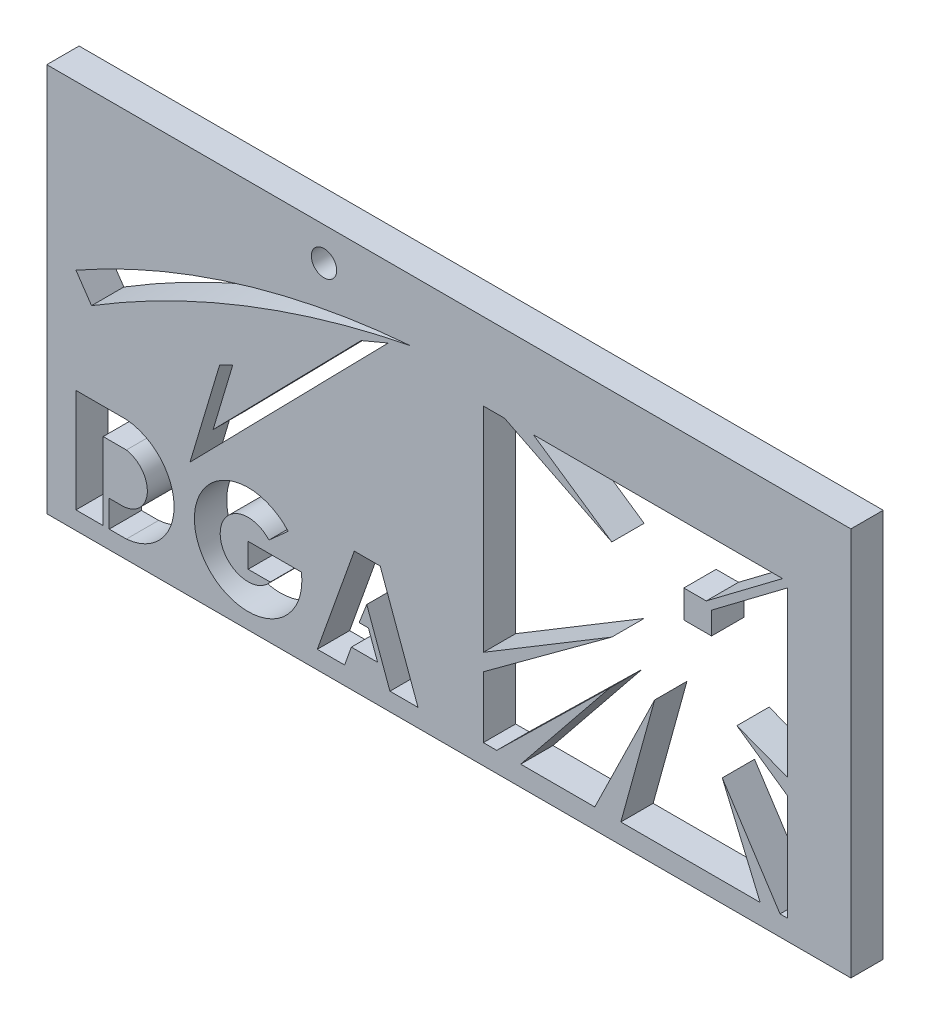
from build123d import *

# Parameters (mm, degrees)
SKETCH1_W           = 248.984951577
SKETCH1_H           = 120.432938534
SKETCH1_R           = 3.927622284
BOSS_EXTRUDE1_DEPTH = 10


with BuildPart() as part:
    # Sketch1 → Boss-Extrude1 (new body)
    with BuildSketch(Plane.XY):
        with Locations((115.469095844, 55.276599595)):
            Rectangle(SKETCH1_W, SKETCH1_H)
        with BuildLine():
            Line((0, 32.653955718), (15.621240173, 32.653955718))
            ThreePointArc((15.621240173, 32.653955718), (30.388379433, 16.62799554), (15.621240173, 0.602035363))
            Line((15.621240173, 0.602035363), (10.293959075, 0.602035363))
            Line((10.293959075, 0.602035363), (10.293959075, 8.861852454))
            Line((10.293959075, 8.861852454), (14.274680474, 8.861852454))
            ThreePointArc((14.274680474, 8.861852454), (22.080061465, 16.061509913), (15.621240173, 24.490191155))
            Line((15.621240173, 24.490191155), (8.429804398, 24.490191155))
            Line((8.429804398, 24.490191155), (8.429804398, 0.602035363))
            Line((8.429804398, 0.602035363), (0, 0.602035363))
            Line((0, 0.602035363), (0, 32.653955718))
        make_face(mode=Mode.SUBTRACT)
        with BuildLine():
            Line((53.313679211, 11.346247394), (53.313679211, 18.830088837))
            Line((53.313679211, 18.830088837), (69.812648012, 18.830088837))
            ThreePointArc((69.812648012, 18.830088837), (38.193038875, 9.668726743), (65.717255622, 27.728287366))
            Line((65.717255622, 27.728287366), (59.75927661, 22.396332813))
            ThreePointArc((59.75927661, 22.396332813), (44.669643003, 16.311643284), (60.163684849, 11.346247394))
            Line((60.163684849, 11.346247394), (53.313679211, 11.346247394))
        make_face(mode=Mode.SUBTRACT)
        Polygon((83.185651108, 0.602035363), (74.742166319, 0.602035363), (86.191958884, 32.653955718), (94.215171192, 32.653955718), (105.915689142, 0.602035363), (97.223875808, 0.602035363), (90.044966021, 20.267647237), (87.696137012, 14.219111042), (90.567743799, 14.219111042), (93.405960474, 6.444216356), (85.272632474, 6.444216356), align=None, mode=Mode.SUBTRACT)
        Polygon((165.929478775, 74.975053885), (141.623819181, 91.5963268), (218.812994732, 91.5963268), (195.166908856, 73.782247188), (188.229793622, 73.782247188), (188.229793622, 65.193610278), (196.812613934, 65.193610278), (196.812613934, 72.134215516), (220.35325448, 89.868856548), (220.35325448, 39.050837541), (204.652216255, 45.070871149), (220.35325448, 34.108892188), (220.35325448, 1.27565402), (218.022003488, 1.27565402), (200.124503338, 28.805885142), (211.866175411, 1.27565402), (168.723408334, 1.27565402), (179.195250301, 39.239610221), (160.65924824, 1.27565402), (137.714117569, 1.27565402), (165.322421142, 35.525080037), (130.296961385, 1.27565402), (126.146157188, 1.27565402), (126.146157188, 20.267647237), (165.929478775, 49.461736063), (126.146157188, 25.486362594), (126.146157188, 91.54755974), (132.709440168, 91.54755974), align=None, mode=Mode.SUBTRACT)
        with BuildLine():
            Line((4.834579987, 57.798227986), (0, 64.897937367))
            ThreePointArc((0, 64.897937367), (50.085795072, 86.302645706), (103.604066377, 96.428999618))
            ThreePointArc((103.604066377, 96.428999618), (52.480961252, 81.558182411), (4.834579987, 57.798227986))
        make_face(mode=Mode.SUBTRACT)
        Polygon((35.321567329, 31.069910316), (44.509426528, 61.76571264), (48.564924823, 63.753147229), (42.461506674, 43.362182051), (88.328778824, 90.179245039), (96.659761905, 93.678257933), align=None, mode=Mode.SUBTRACT)
        with Locations((76.813345198, 105.179515455)):
            Circle(SKETCH1_R, mode=Mode.SUBTRACT)
    extrude(amount=BOSS_EXTRUDE1_DEPTH)


solid = part.part
